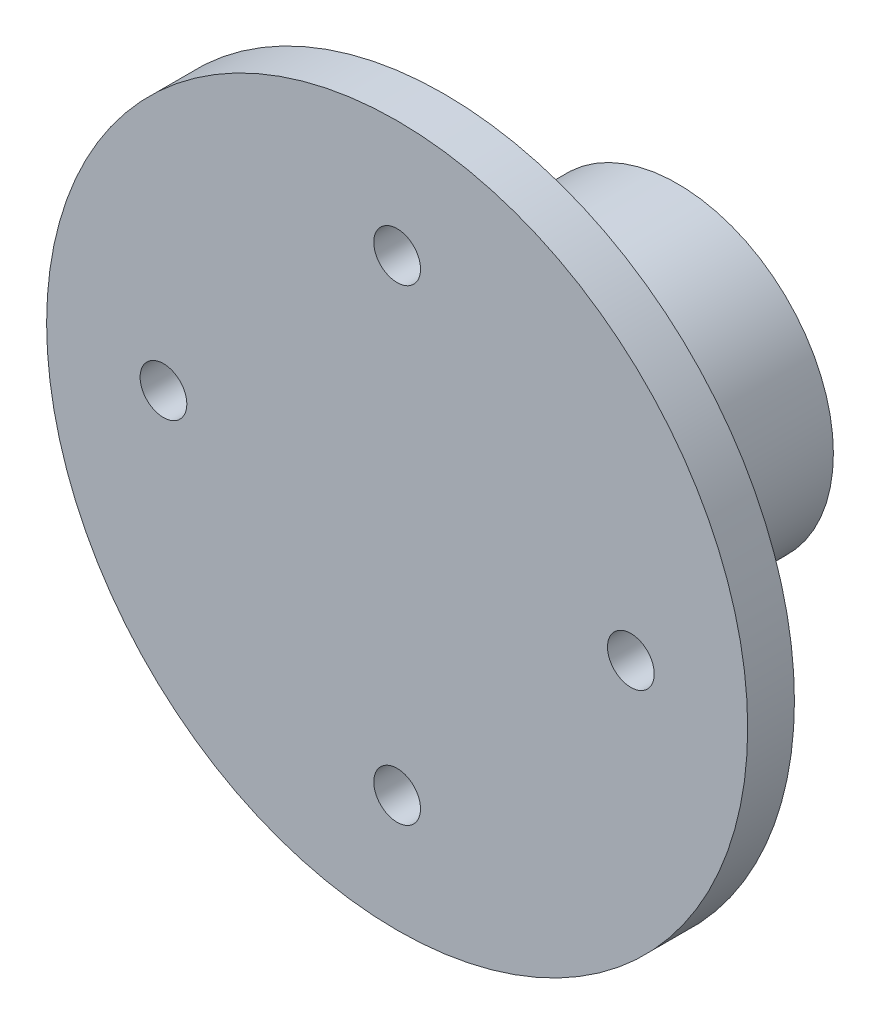
from build123d import *

# Parameters (mm, degrees)
SKETCH2_R           = 22.5
BOSS_EXTRUDE1_DEPTH = 3
SKETCH3_R           = 10
SKETCH3_R_2         = 7
BOSS_EXTRUDE2_DEPTH = 15
SKETCH1_R           = 1.5
CUT_EXTRUDE1_DEPTH  = 9


with BuildPart() as part:
    # Sketch2 → Boss-Extrude1 (new body)
    with BuildSketch(Plane.XY):
        with Locations((0, 10)):
            Circle(SKETCH2_R)
    extrude(amount=BOSS_EXTRUDE1_DEPTH)

    # Sketch3 → Boss-Extrude2 (add)
    with BuildSketch(Plane(origin=(0, 0, 0), x_dir=(-1, 0, 0), z_dir=(0, 0, -1))):
        with Locations(Location((0, 10, 0), (0, 0, 180))):
            Circle(SKETCH3_R)
        with Locations((0, 10)):
            Circle(SKETCH3_R_2, mode=Mode.SUBTRACT)
    extrude(amount=BOSS_EXTRUDE2_DEPTH)

    # Sketch1 → Cut-Extrude1 (cut)
    with BuildSketch(Plane.XY):
        with Locations((0, 25)):
            Circle(SKETCH1_R)
        with Locations((15, 10)):
            Circle(SKETCH1_R)
        with Locations((0, -5)):
            Circle(SKETCH1_R)
        with Locations((-15, 10)):
            Circle(SKETCH1_R)
    extrude(amount=CUT_EXTRUDE1_DEPTH, mode=Mode.SUBTRACT)


solid = part.part
